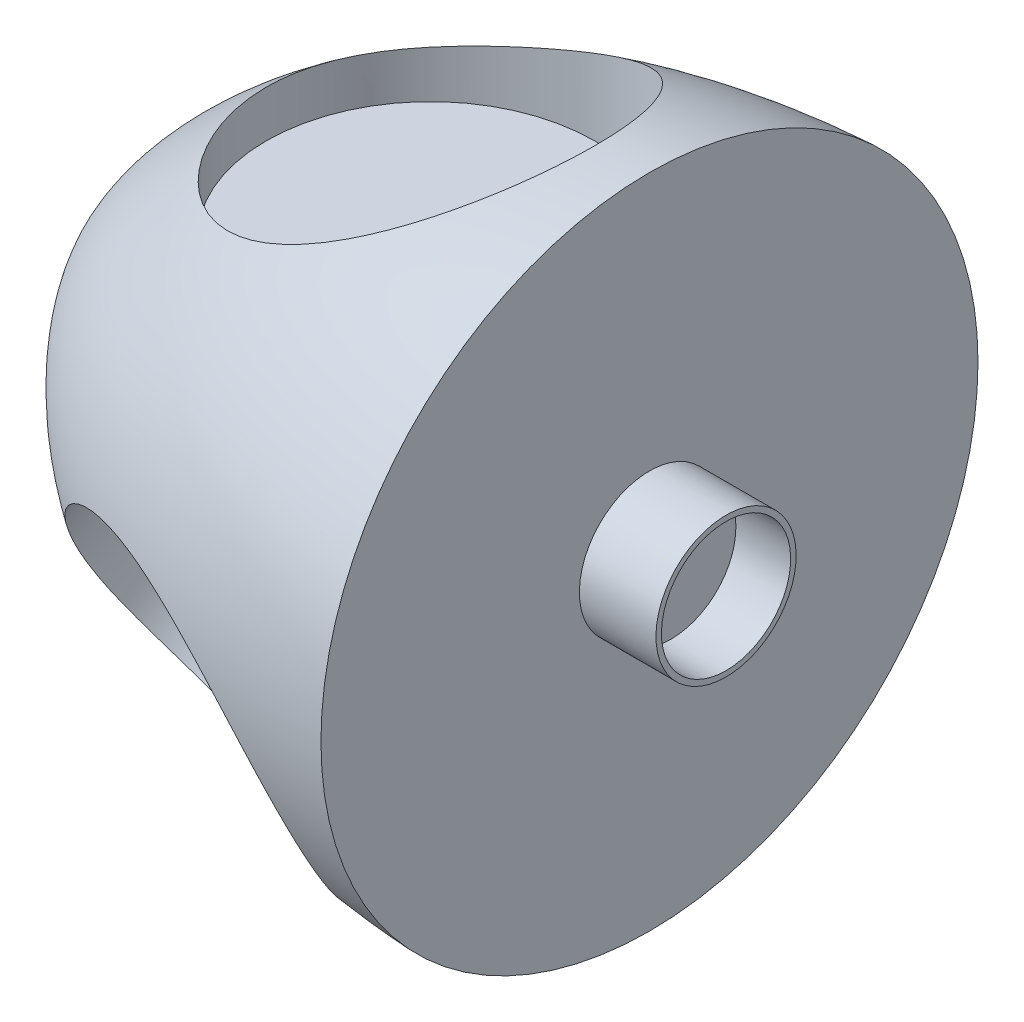
from build123d import *

# Parameters (mm, degrees)
SKETCH2_R          = 1500
CUT_EXTRUDE1_DEPTH = 1500
CIRPATTERN1_COUNT  = 3


with BuildPart() as part:
    # Sketch1 → Revolve1 (revolve)
    with BuildSketch(Plane.XY):
        with BuildLine():
            Line((0, 0), (-5000, 0))
            add(Edge.make_bspline(
                [(0, 3000), (-1941.232650508, 2903.079546126), (-4138.125517244, 2194.727419517), (-5000, 0)],
                knots=[0, 0, 0, 0, 1, 1, 1, 1], degree=3))
            Line((0, 3000), (0, 0))
        make_face()
    revolve(axis=Axis((0, 0, 0), (-1, 0, 0)))

    # Sketch2 → Cut-Extrude1 (cut)
    with BuildSketch(Plane(origin=(0, 3000, 0), x_dir=(1, 0, 0), z_dir=(0, 1, 0))):
        with Locations(Location((-2000, 0, 0), (0, 0, 270))):
            Circle(SKETCH2_R)
    cut_extrude1 = extrude(amount=-CUT_EXTRUDE1_DEPTH, mode=Mode.SUBTRACT)

    # CirPattern1: Cut-Extrude1 ×3 about axis
    cirpattern1_axis = Axis((0, 0, 0), (1, 0, 0))
    for i in range(1, CIRPATTERN1_COUNT):
        add(cut_extrude1.rotate(cirpattern1_axis, i * 360 / CIRPATTERN1_COUNT), mode=Mode.SUBTRACT)

    # Sketch5 → Revolve2 (revolve)
    with BuildSketch(Plane(origin=(0, 0, 0), x_dir=(-1, 0, 0), z_dir=(0, -0.8660254037844363, -0.5000000000000043)), mode=Mode.PRIVATE) as revolve2_sk:
        Polygon((0, 0), (0, 640), (-699.266659893, 640), (-699.266659893, 590), (-199.266659893, 590), (-199.266659893, 0), align=None)
    revolve(revolve2_sk.sketch.rotate(Axis((0, 0, 0), (1, 0, 0)), 240), axis=Axis((0, 0, 0), (1, 0, 0)))


solid = part.part
